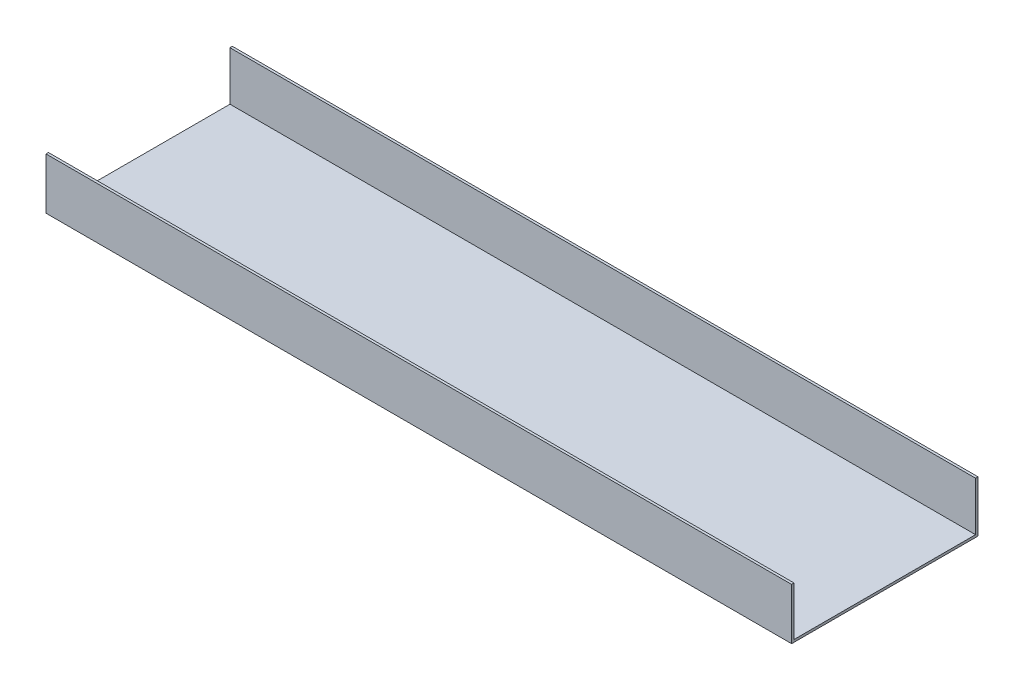
from build123d import *

# Parameters (mm, degrees)
SKETCH1_W           = 304.8
SKETCH1_H           = 76.2
BOSS_EXTRUDE1_DEPTH = 1
SKETCH2_W           = 304.8
SKETCH2_H           = 1
EXTRUDE_THIN1_DEPTH = 20
SKETCH5_W           = 304.8
SKETCH5_H           = 1
EXTRUDE_THIN2_DEPTH = 20


with BuildPart() as part:
    # Sketch1 → Boss-Extrude1 (new body)
    with BuildSketch(Plane(origin=(0, 0, 0), x_dir=(1, 0, 0), z_dir=(0, 1, 0))):
        Rectangle(SKETCH1_W, SKETCH1_H)
    extrude(amount=BOSS_EXTRUDE1_DEPTH)

    # Sketch2 → Extrude-Thin1 (add)
    with BuildSketch(Plane(origin=(0, 1, 0), x_dir=(1, 0, 0), z_dir=(0, 1, 0))):
        with Locations((0, -37.6)):
            Rectangle(SKETCH2_W, SKETCH2_H)
    extrude(amount=EXTRUDE_THIN1_DEPTH)

    # Sketch5 → Extrude-Thin2 (add)
    with BuildSketch(Plane(origin=(0, 1, 0), x_dir=(1, 0, 0), z_dir=(0, 1, 0))):
        with Locations((0, 37.6)):
            Rectangle(SKETCH5_W, SKETCH5_H)
    extrude(amount=EXTRUDE_THIN2_DEPTH)


solid = part.part
